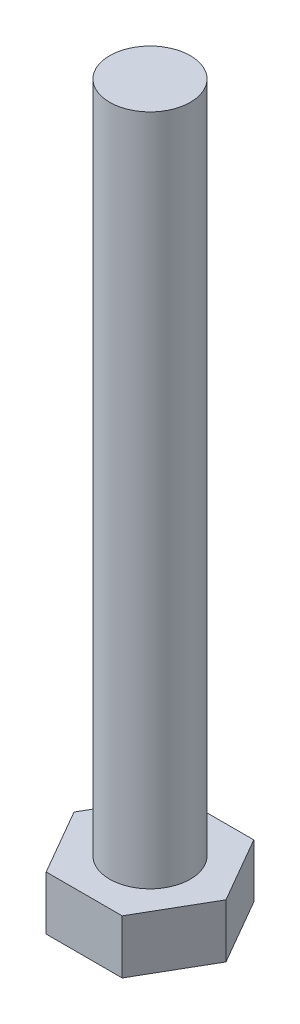
from build123d import *

# Parameters (mm, degrees)
BOSS_EXTRUDE1_DEPTH = 4
SKETCH2_R           = 3
BOSS_EXTRUDE2_DEPTH = 50


with BuildPart() as part:
    # Sketch1 → Boss-Extrude1 (new body)
    with BuildSketch(Plane(origin=(0, 0, 0), x_dir=(1, 0, 0), z_dir=(0, 1, 0))):
        Polygon((2.823242816, -4.89), (5.646485633, 0), (2.823242816, 4.89), (-2.823242816, 4.89), (-5.646485633, 0), (-2.823242816, -4.89), align=None)
    extrude(amount=BOSS_EXTRUDE1_DEPTH)

    # Sketch2 → Boss-Extrude2 (add)
    with BuildSketch(Plane(origin=(0, 4, 0), x_dir=(1, 0, 0), z_dir=(0, 1, 0))):
        with Locations(Location((0, 0, 0), (0, 0, 270))):
            Circle(SKETCH2_R)
    extrude(amount=BOSS_EXTRUDE2_DEPTH)


solid = part.part
